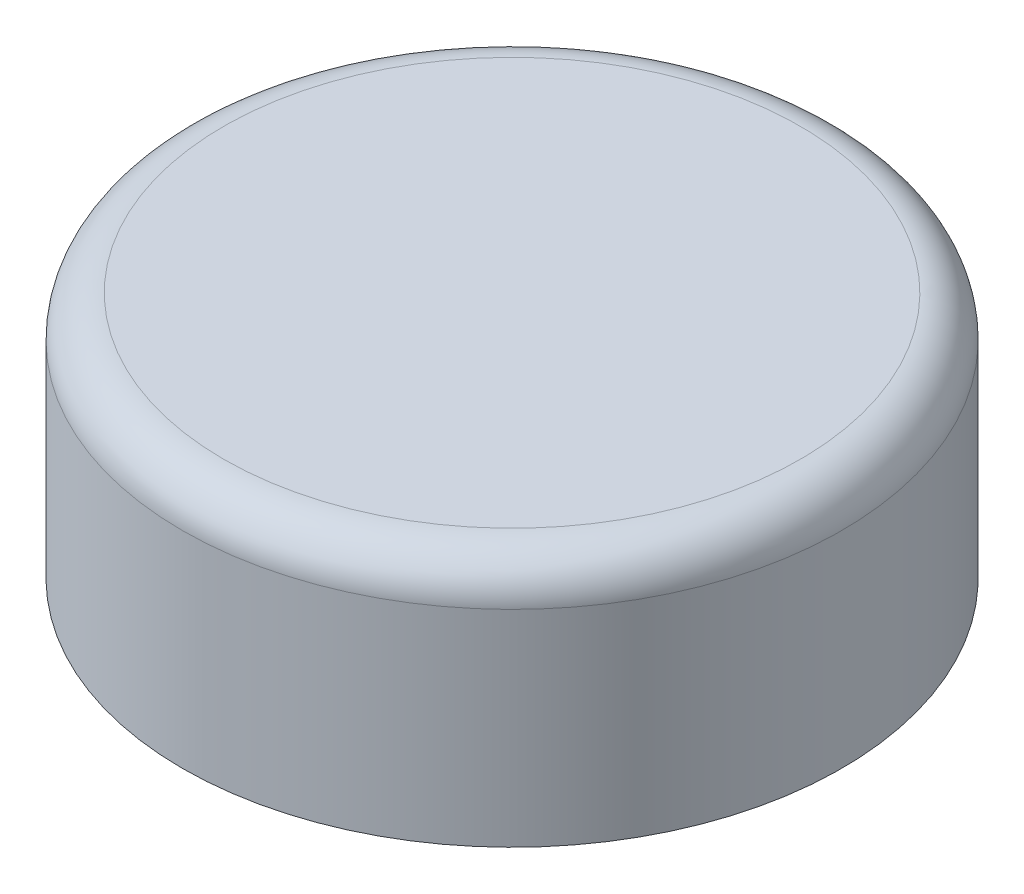
from build123d import *

# Parameters (mm, degrees)
SKETCH1_R           = 40
BOSS_EXTRUDE1_DEPTH = 30
FILLET1_R           = 5
SKETCH2_R           = 36
CUT_EXTRUDE1_DEPTH  = 25


with BuildPart() as part:
    # Sketch1 → Boss-Extrude1 (new body)
    with BuildSketch(Plane(origin=(0, 0, 0), x_dir=(1, 0, 0), z_dir=(0, 1, 0))):
        with Locations(Location((0, 0, 0), (0, 0, 270))):
            Circle(SKETCH1_R)
    extrude(amount=BOSS_EXTRUDE1_DEPTH)

    # Fillet1
    fillet1_edges = [part.edges().sort_by_distance(p)[0] for p in [
        (0, 30, -40),
    ]]
    fillet(fillet1_edges, radius=FILLET1_R)

    # Sketch2 → Cut-Extrude1 (cut)
    with BuildSketch(Plane.XZ):
        with Locations(Location((0, 0, 0), (0, 0, 270))):
            Circle(SKETCH2_R)
    extrude(amount=-CUT_EXTRUDE1_DEPTH, mode=Mode.SUBTRACT)


solid = part.part
